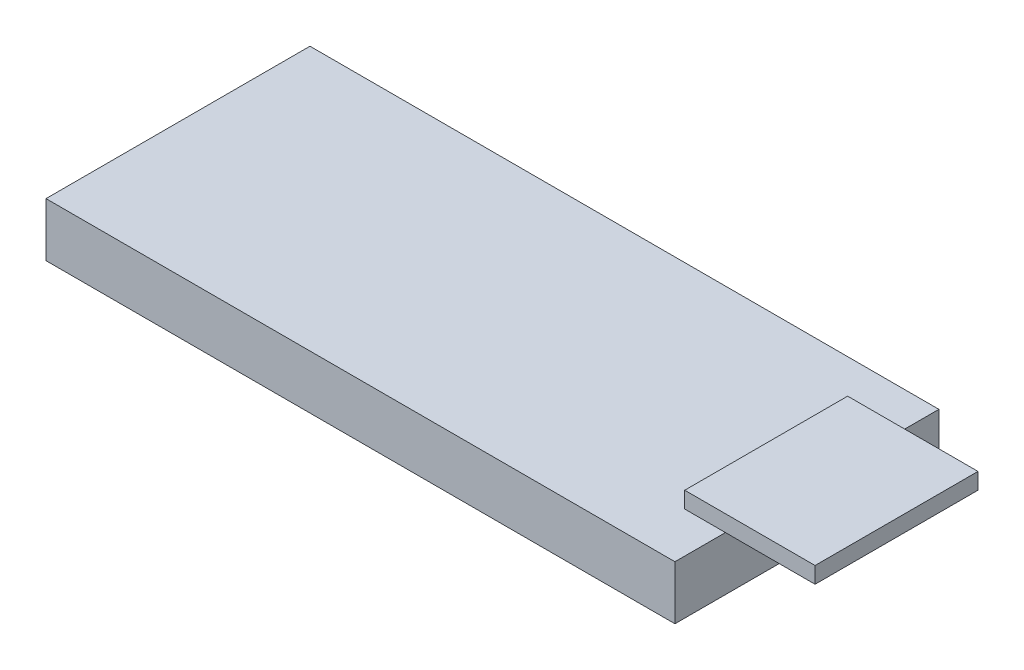
from build123d import *

# Parameters (mm, degrees)
SKETCH_1_W      = 38.6
SKETCH_1_H      = 16.2
EXTRUDE_1_DEPTH = 3.3
SKETCH_2_W      = 2.5
SKETCH_2_H      = 10
EXTRUDE_2_DEPTH = 1
SKETCH_3_W      = 10
SKETCH_3_H      = 1
EXTRUDE_3_DEPTH = 5.5


with BuildPart() as part:
    # 草图1 → 凸台-拉伸1 (new body)
    with BuildSketch(Plane(origin=(0, 0, 0), x_dir=(1, 0, 0), z_dir=(0, 1, 0))):
        with Locations((19.3, 8.1)):
            Rectangle(SKETCH_1_W, SKETCH_1_H)
    extrude(amount=EXTRUDE_1_DEPTH)

    # 草图2 → 凸台-拉伸2 (add)
    with BuildSketch(Plane(origin=(0, 3.3, 0), x_dir=(1, 0, 0), z_dir=(0, 1, 0))):
        with Locations((37.35, 8.1)):
            Rectangle(SKETCH_2_W, SKETCH_2_H)
    extrude(amount=EXTRUDE_2_DEPTH)

    # 草图3 → 凸台-拉伸3 (add)
    with BuildSketch(Plane(origin=(38.6, 0, 0), x_dir=(0, 0, -1), z_dir=(1, 0, 0))):
        with Locations((8.1, 3.8)):
            Rectangle(SKETCH_3_W, SKETCH_3_H)
    extrude(amount=EXTRUDE_3_DEPTH)


solid = part.part
